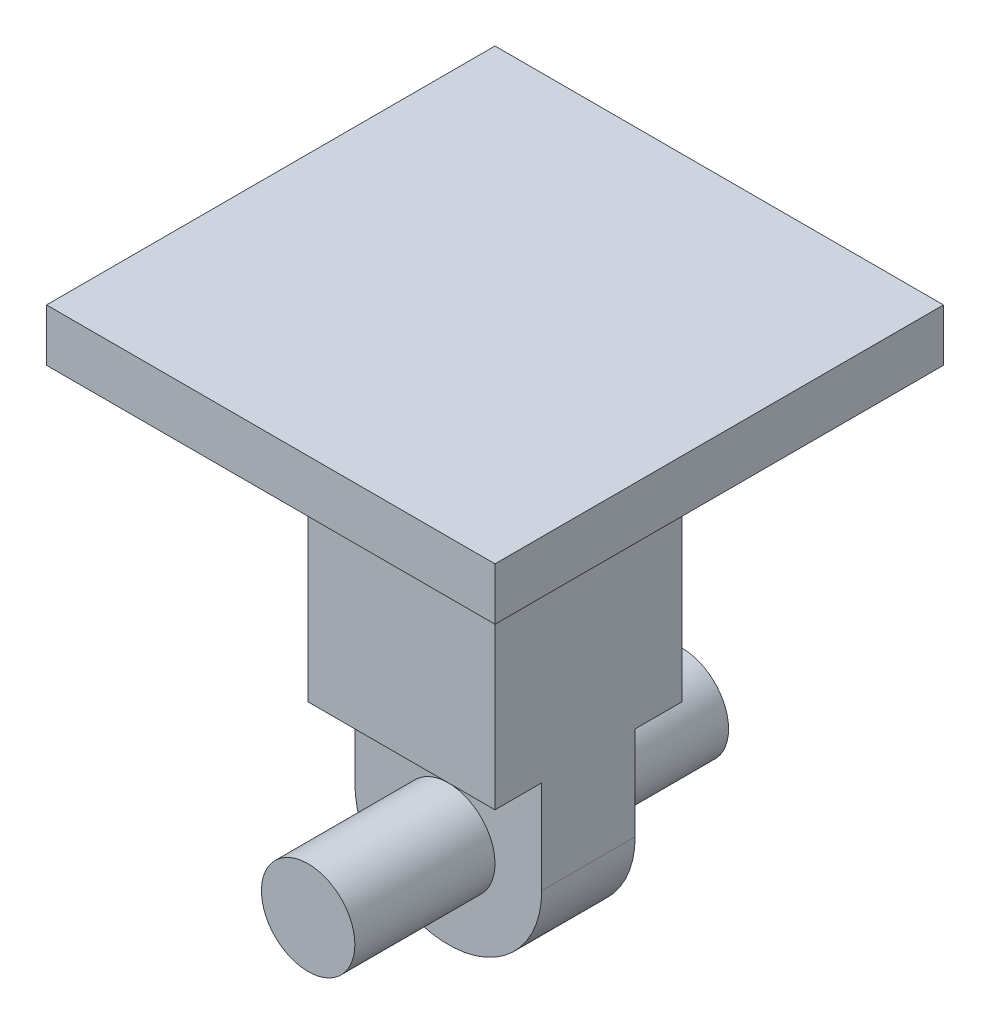
from build123d import *

# Parameters (mm, degrees)
SKETCH_1_W           = 60
SKETCH_1_H           = 60
EXTRUDE_1_DEPTH      = 7
SKETCH_3_W           = 25
SKETCH_3_H           = 25
EXTRUDE_2_DEPTH      = 51.5
EXTRUDE_START        = 12.5
EXTRUDE_3_DEPTH      = 25
CUT_EXTRUDE_START    = -64
SKETCH_7_W           = 25
SKETCH_7_H           = 6.25
CUT_EXTRUDE_3_DEPTH  = 25
EXTRUDE_4_DEPTH      = 25
EXTRUDE_4_DEPTH_BACK = 25
SKETCH_8_R           = 6.25


with BuildPart() as part:
    # 草图1 → 凸台-拉伸1 (new body)
    with BuildSketch(Plane(origin=(0, 0, 0), x_dir=(1, 0, 0), z_dir=(0, 1, 0))):
        Rectangle(SKETCH_1_W, SKETCH_1_H)
    extrude(amount=EXTRUDE_1_DEPTH)

    # 草图3 → 凸台-拉伸2 (add)
    with BuildSketch(Plane(origin=(0, 0, 0), x_dir=(1, 0, 0), z_dir=(0, 1, 0))):
        Rectangle(SKETCH_3_W, SKETCH_3_H)
    extrude(amount=-EXTRUDE_2_DEPTH)

    # 草图4 → 凸台-拉伸3 (add)
    with BuildSketch(Plane.XY.offset(EXTRUDE_START)):
        with BuildLine():
            Line((12.5, -51.5), (-12.5, -51.5))
            ThreePointArc((-12.5, -51.5), (0, -64), (12.5, -51.5))
        make_face()
    extrude(amount=-EXTRUDE_3_DEPTH)

    # 草图7 → 切除-拉伸3 (cut)
    with BuildSketch(Plane(origin=(0, 0, 0), x_dir=(1, 0, 0), z_dir=(0, 1, 0)).offset(CUT_EXTRUDE_START)):
        with Locations((0, 9.375)):
            Rectangle(SKETCH_7_W, SKETCH_7_H)
        with Locations((0, -9.375)):
            Rectangle(SKETCH_7_W, SKETCH_7_H)
    extrude(amount=CUT_EXTRUDE_3_DEPTH, mode=Mode.SUBTRACT)

    # 草图8 → 凸台-拉伸4 (add, two sides: drawn at the far end of the back side and taken through both)
    with BuildSketch(Plane.XY.offset(-EXTRUDE_4_DEPTH_BACK)):
        with Locations((0, -51.5)):
            Circle(SKETCH_8_R)
    extrude(amount=EXTRUDE_4_DEPTH + EXTRUDE_4_DEPTH_BACK)


solid = part.part
